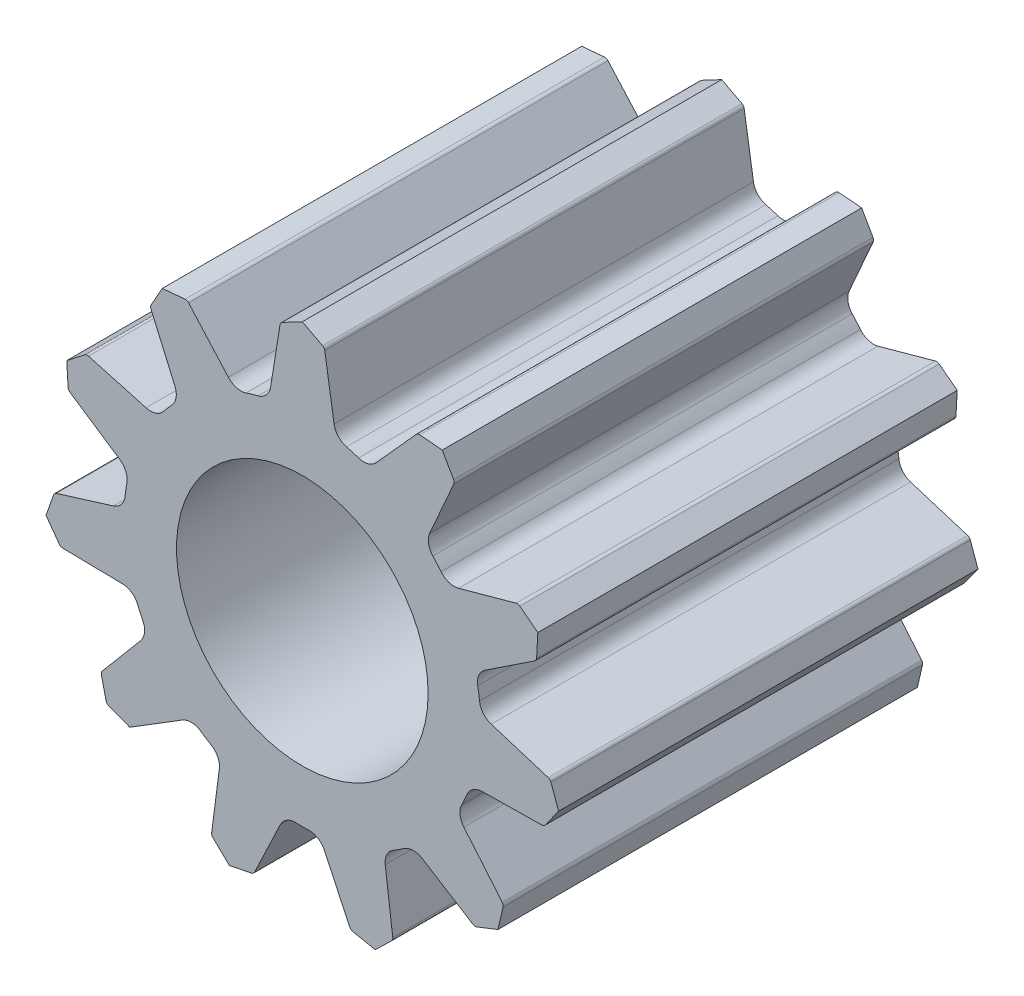
from build123d import *

# Parameters (mm, degrees)
SKETCH1_R           = 4.25
BOSS_EXTRUDE1_DEPTH = 10
BOSS_EXTRUDE2_DEPTH = 10
CIRPATTERN1_COUNT   = 11
SKETCH5_R           = 3
CUT_EXTRUDE1_DEPTH  = 10
FILLET1_R           = 0.4
FILLET2_R           = 0.1


with BuildPart() as part:
    # Sketch1 → Boss-Extrude1 (new body)
    with BuildSketch(Plane.XY):
        Circle(SKETCH1_R)
    extrude(amount=BOSS_EXTRUDE1_DEPTH)

    # Sketch3 → Boss-Extrude2 (add)
    with BuildSketch(Plane.XY):
        Polygon((0, 6.174026833), (0.527734359, 5.897416886), (0.8, 4.174026833), (-0.8, 4.174026833), (-0.522537345, 5.897416886), align=None)
    boss_extrude2 = extrude(amount=BOSS_EXTRUDE2_DEPTH)

    # CirPattern1: Boss-Extrude2 ×11 about axis
    cirpattern1_axis = Axis((0, 0, 0), (0, 0, 1))
    for i in range(1, CIRPATTERN1_COUNT):
        add(boss_extrude2.rotate(cirpattern1_axis, i * 360 / CIRPATTERN1_COUNT))

    # Sketch5 → Cut-Extrude1 (cut)
    with BuildSketch(Plane.XY):
        Circle(SKETCH5_R)
    extrude(amount=CUT_EXTRUDE1_DEPTH, mode=Mode.SUBTRACT)

    # Fillet1
    fillet1_edges = [part.edges().sort_by_distance(p)[0] for p in [
        (1.943553631, -3.779563372, 5),
        (0.408364873, -4.230335463, 5),
        (3.678407589, -2.128806616, 5),
        (2.630630415, -3.338005935, 5),
        (4.245393129, 0.1978312, 5),
        (4.017689387, -1.385883107, 5),
        (3.464496346, 2.461659007, 5),
        (4.129160367, 1.006247815, 5),
        (1.583646453, 3.943927473, 5),
        (2.929652105, 3.078902165, 5),
        (-2.929652105, 3.078902165, 5),
        (-1.583646453, 3.943927473, 5),
        (-4.129160367, 1.006247815, 5),
        (-3.464496346, 2.461659007, 5),
        (-4.017689387, -1.385883107, 5),
        (-4.245393129, 0.1978312, 5),
        (-2.630630415, -3.338005935, 5),
        (-3.678407589, -2.128806616, 5),
        (-0.408364873, -4.230335463, 5),
        (-1.943553631, -3.779563372, 5),
        (-0.8, 4.174026833, 5),
        (0.8, 4.174026833, 5),
    ]]
    fillet(fillet1_edges, radius=FILLET1_R)

    # Fillet2
    fillet2_edges = [part.edges().sort_by_distance(p)[0] for p in [
        (0.527734359, 5.897416886, 5),
        (2.162865249, -5.511314283, 5),
        (1.155136929, -5.807210015, 5),
        (4.799159491, -3.467079374, 5),
        (4.111377792, -4.260821767, 5),
        (5.911754503, -0.322071262, 5),
        (5.762285256, -1.361652714, 5),
        (5.147409232, 2.9251922, 5),
        (5.583707865, 1.969831455, 5),
        (2.748797899, 5.243727807, 5),
        (3.63234268, 4.675908055, 5),
        (-3.627970674, 4.678717773, 5),
        (-2.744425893, 5.246537525, 5),
        (-5.581548948, 1.974558825, 5),
        (-5.145250314, 2.92991957, 5),
        (-5.763024868, -1.356508599, 5),
        (-5.912494116, -0.316927147, 5),
        (-4.666018151, -4.043127743, 5),
        (-4.802562811, -3.463151734, 5),
        (-1.160123427, -5.805745847, 5),
        (-2.167851747, -5.509850115, 5),
        (-0.522537345, 5.897416886, 5),
    ]]
    fillet(fillet2_edges, radius=FILLET2_R)


solid = part.part
